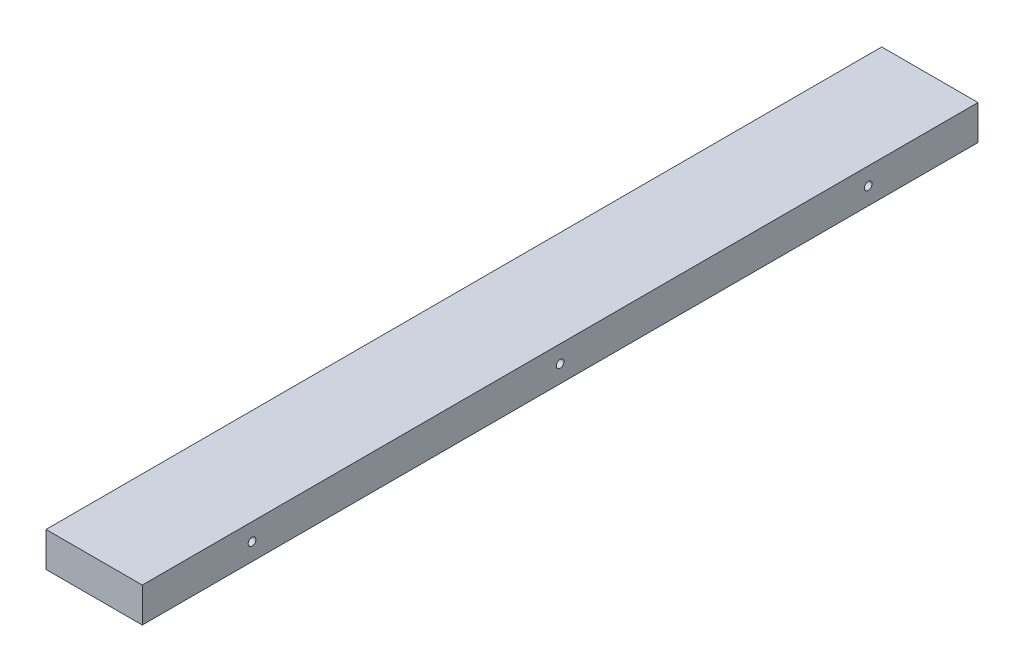
from build123d import *

# Parameters (mm, degrees)
SKETCH1_W                    = 50
SKETCH1_H                    = 434
BOSS_EXTRUDE1_DEPTH          = 18
F_4_0_4_DIAMETER_HOLE3_D     = 4
F_4_0_4_DIAMETER_HOLE3_DEPTH = 30
F_4_0_4_DIAMETER_HOLE3_TIP   = 1.201721238
F_4_0_4_DIAMETER_HOLE4_D     = 4
F_4_0_4_DIAMETER_HOLE4_DEPTH = 30
F_4_0_4_DIAMETER_HOLE4_TIP   = 1.201721238


with BuildPart() as part:
    # Sketch1 → Boss-Extrude1 (new body)
    with BuildSketch(Plane(origin=(0, 0, 0), x_dir=(1, 0, 0), z_dir=(0, 1, 0))):
        Rectangle(SKETCH1_W, SKETCH1_H)
    extrude(amount=BOSS_EXTRUDE1_DEPTH)

    # Ø4.0 (4) Diameter Hole3
    with Locations(Plane(origin=(25, 0, 0), x_dir=(0, 0, -1), z_dir=(1, 0, 0))):
        with Locations((160, 9), (0, 9), (-160, 9)):
            Hole(F_4_0_4_DIAMETER_HOLE3_D / 2, depth=F_4_0_4_DIAMETER_HOLE3_DEPTH)
            with Locations((0, 0, -(F_4_0_4_DIAMETER_HOLE3_DEPTH + F_4_0_4_DIAMETER_HOLE3_TIP / 2))):  # 118° drill point
                Cone(0, F_4_0_4_DIAMETER_HOLE3_D / 2, F_4_0_4_DIAMETER_HOLE3_TIP, mode=Mode.SUBTRACT)

    # Ø4.0 (4) Diameter Hole4
    with Locations(Plane.ZY.offset(25)):
        with Locations((180, 9), (60, 9), (-60, 9), (-180, 9)):
            Hole(F_4_0_4_DIAMETER_HOLE4_D / 2, depth=F_4_0_4_DIAMETER_HOLE4_DEPTH)
            with Locations((0, 0, -(F_4_0_4_DIAMETER_HOLE4_DEPTH + F_4_0_4_DIAMETER_HOLE4_TIP / 2))):  # 118° drill point
                Cone(0, F_4_0_4_DIAMETER_HOLE4_D / 2, F_4_0_4_DIAMETER_HOLE4_TIP, mode=Mode.SUBTRACT)


solid = part.part
